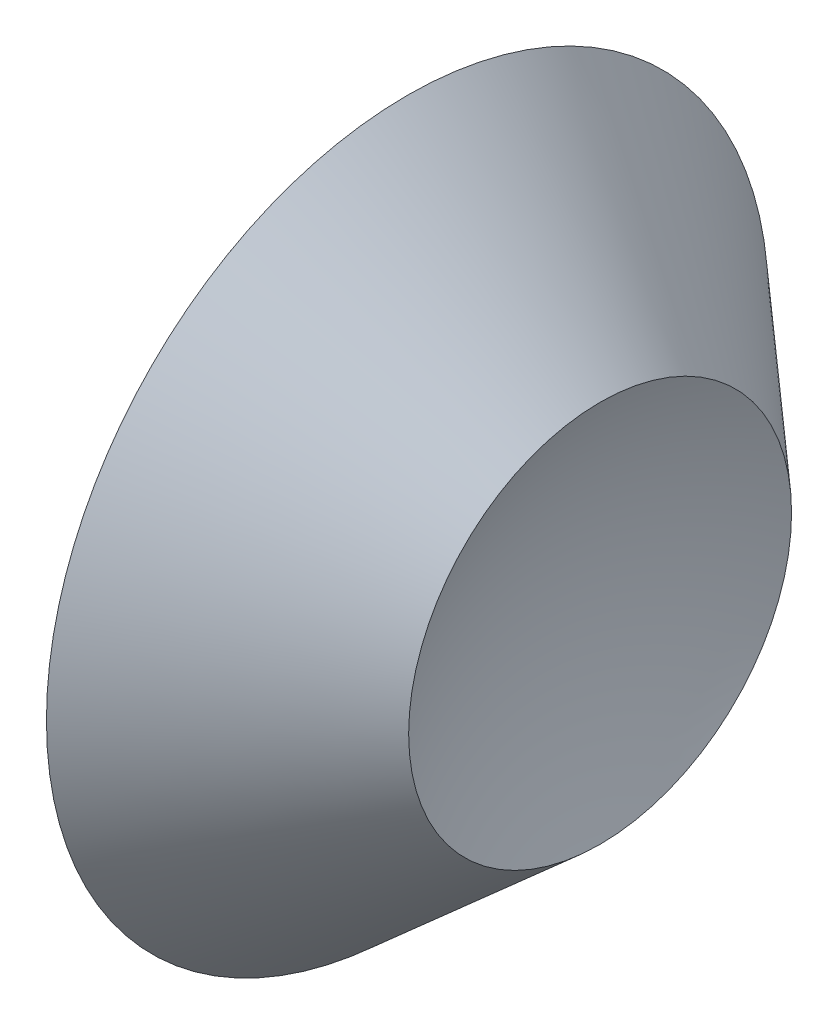
from build123d import *


with BuildPart() as part:
    # 草图1 → 旋转1 (revolve)
    with BuildSketch(Plane.XY, mode=Mode.PRIVATE) as revolve_1_sk:
        with BuildLine():
            Line((-55, 0), (-53.367559904, 0))
            ThreePointArc((-53.367559904, 0), (-53.274609358, 0.95569726), (-52.999241783, 1.875572119))
            Line((-52.999241783, 1.875572119), (-54.88615803, 3.5368993))
            ThreePointArc((-54.88615803, 3.5368993), (-54.97153214, 1.769365469), (-55, 0))
        make_face()
    revolve(revolve_1_sk.sketch.rotate(Axis((-55, 0, 0), (1, 0, 0)), 90), axis=Axis((-55, 0, 0), (1, 0, 0)))


solid = part.part
